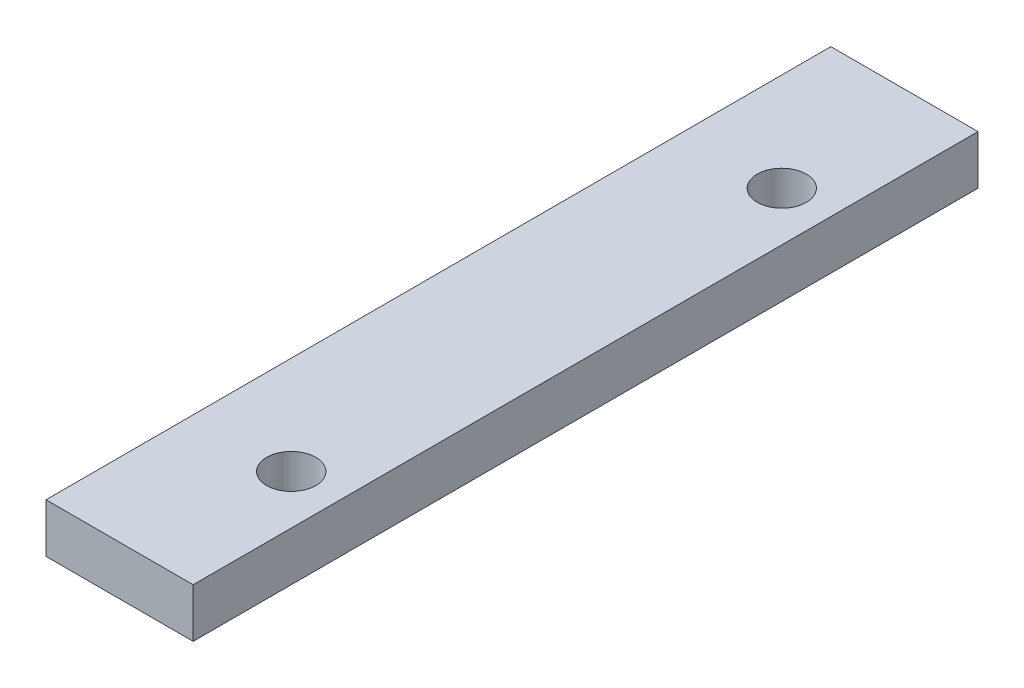
from build123d import *

# Parameters (mm, degrees)
SKETCH1_W                   = 19.05
SKETCH1_H                   = 101.6
BOSS_EXTRUDE1_DEPTH         = 3.175
F_1_4_0_25_DIAMETER_HOLE1_D = 6.35


with BuildPart() as part:
    # Sketch1 → Boss-Extrude1 (new, symmetric)
    with BuildSketch(Plane(origin=(0, 0, 0), x_dir=(1, 0, 0), z_dir=(0, 1, 0))):
        Rectangle(SKETCH1_W, SKETCH1_H)
    extrude(amount=BOSS_EXTRUDE1_DEPTH, both=True)

    # 1/4 (0.25) Diameter Hole1 (through all)
    with Locations(Plane(origin=(0, 3.175, 0), x_dir=(1, 0, 0), z_dir=(0, 1, 0))):
        with Locations((3.175, -31.75), (3.175, 31.75)):
            Hole(F_1_4_0_25_DIAMETER_HOLE1_D / 2)


solid = part.part
